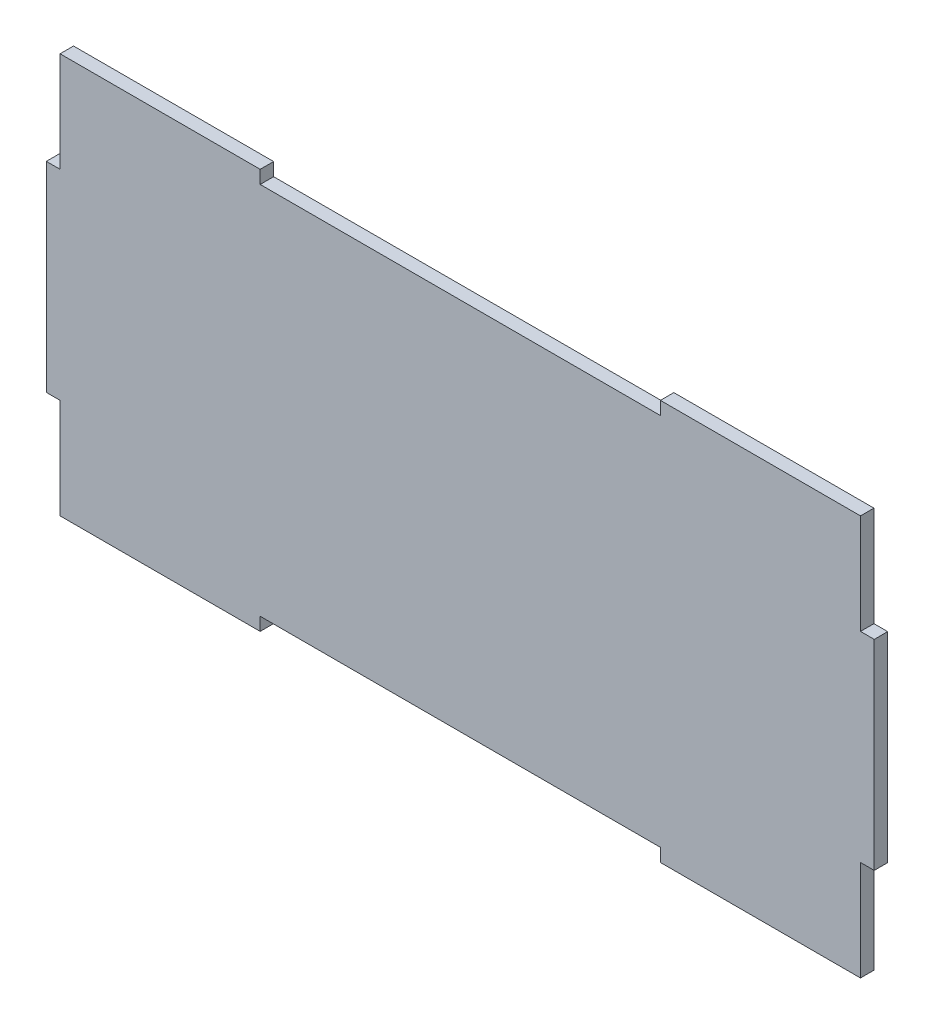
from build123d import *

# Parameters (mm, degrees)
SKETCH1_W           = 200
SKETCH1_H           = 100
BOSS_EXTRUDE1_DEPTH = 3.36
SKETCH9_W           = 3.44
SKETCH9_H           = 50
BOSS_EXTRUDE5_DEPTH = 3.36
SKETCH10_W          = 100
SKETCH10_H          = 3.28
CUT_EXTRUDE1_DEPTH  = 3.36


with BuildPart() as part:
    # Sketch1 → Boss-Extrude1 (new body)
    with BuildSketch(Plane.XY):
        Rectangle(SKETCH1_W, SKETCH1_H)
    extrude(amount=BOSS_EXTRUDE1_DEPTH)

    # Sketch9 → Boss-Extrude5 (add)
    with BuildSketch(Plane(origin=(0, 0, 0), x_dir=(-1, 0, 0), z_dir=(0, 0, -1))):
        with Locations((101.72, 0)):
            Rectangle(SKETCH9_W, SKETCH9_H)
    boss_extrude5 = extrude(amount=-BOSS_EXTRUDE5_DEPTH)

    # Mirror5: Boss-Extrude5 across plane
    add(boss_extrude5.mirror(Plane(origin=(0, 0, 0), x_dir=(0, 0, 1), z_dir=(1, 0, 0))))

    # Sketch10 → Cut-Extrude1 (cut)
    with BuildSketch(Plane.XY.offset(3.36)):
        with Locations((0, 48.36)):
            Rectangle(SKETCH10_W, SKETCH10_H)
    cut_extrude1 = extrude(amount=-CUT_EXTRUDE1_DEPTH, mode=Mode.SUBTRACT)

    # Mirror6: Cut-Extrude1 across plane
    add(cut_extrude1.mirror(Plane.ZX), mode=Mode.SUBTRACT)


solid = part.part
